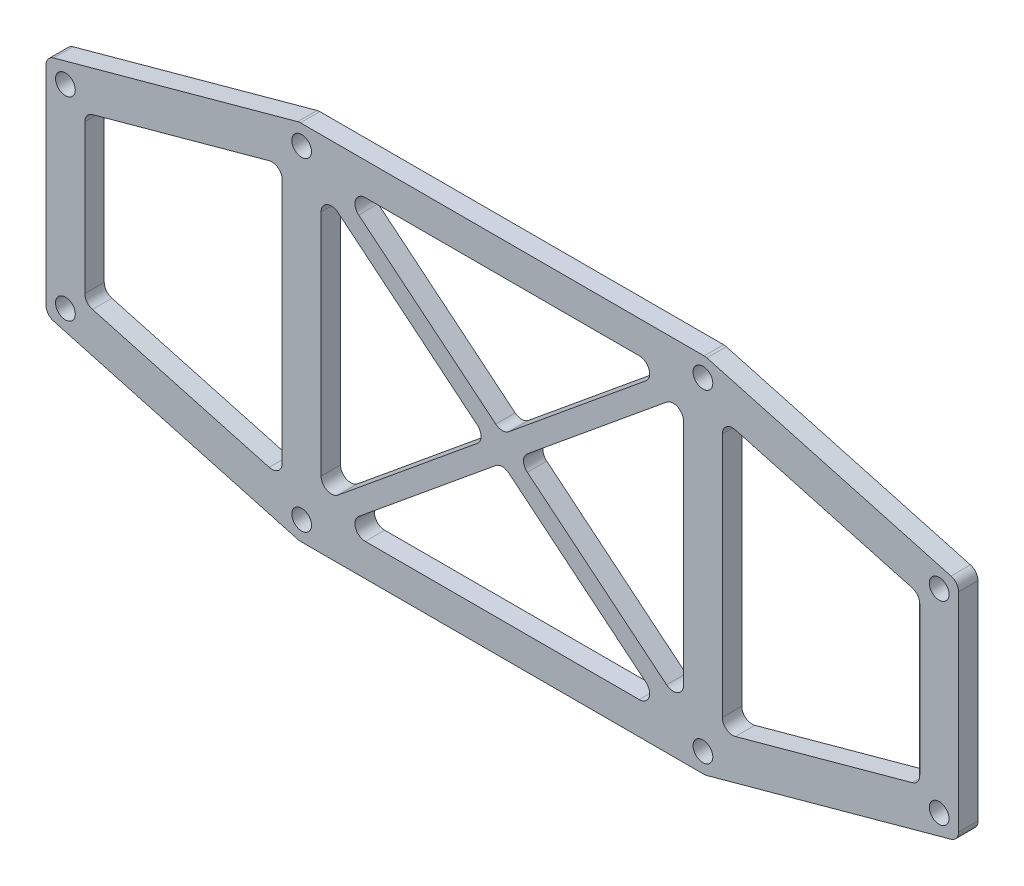
from build123d import *

# Parameters (mm, degrees)
SKETCH_1_R          = 1.525
EXTRUDE_1_DEPTH     = 3
CUT_EXTRUDE_1_DEPTH = 3
CUT_EXTRUDE_2_DEPTH = 3
FILLET_1_R          = 1.6


with BuildPart() as part:
    # 草图1 → 凸台-拉伸1 (new body)
    with BuildSketch(Plane.XY):
        Polygon((-70.5, 17.288636625), (-31.403523682, 28), (31.403523682, 28), (70.5, 17.288636625), (70.5, -17.288636625), (31.403523682, -28), (-31.403523682, -28), (-70.5, -17.288636625), align=None)
        with Locations((31, 25)):
            Circle(SKETCH_1_R, mode=Mode.SUBTRACT)
        with Locations((-31, 25)):
            Circle(SKETCH_1_R, mode=Mode.SUBTRACT)
        with Locations((-31, -25)):
            Circle(SKETCH_1_R, mode=Mode.SUBTRACT)
        with Locations((31, -25)):
            Circle(SKETCH_1_R, mode=Mode.SUBTRACT)
        with Locations((-67.5, -15)):
            Circle(SKETCH_1_R, mode=Mode.SUBTRACT)
        with Locations((-67.5, 15)):
            Circle(SKETCH_1_R, mode=Mode.SUBTRACT)
        with Locations((67.5, 15)):
            Circle(SKETCH_1_R, mode=Mode.SUBTRACT)
        with Locations((67.5, -15)):
            Circle(SKETCH_1_R, mode=Mode.SUBTRACT)
    extrude(amount=EXTRUDE_1_DEPTH)

    # 草图2 → 切除-拉伸1 (cut)
    with BuildSketch(Plane.XY.offset(3)):
        Polygon((-28, 21.058820972), (-28, -21.058820972), (-2.363174469, 0), align=None)
        Polygon((0, -1.941179028), (-25.636825531, -23), (25.636825531, -23), align=None)
        Polygon((28, 21.058820972), (2.363174469, 0), (28, -21.058820972), align=None)
        Polygon((-25.636825531, 23), (0, 1.941179028), (25.636825531, 23), align=None)
    extrude(amount=-CUT_EXTRUDE_1_DEPTH, mode=Mode.SUBTRACT)

    # 草图3 → 切除-拉伸2 (cut)
    with BuildSketch(Plane.XY.offset(3)):
        Polygon((34, 21.067527758), (34, -21.067527758), (64.5, -12.711363375), (64.5, 12.711363375), align=None)
        Polygon((-64.5, 12.711363375), (-34, 21.067527758), (-34, -21.067527758), (-64.5, -12.711363375), align=None)
    extrude(amount=-CUT_EXTRUDE_2_DEPTH, mode=Mode.SUBTRACT)

    # 圆角1
    fillet_1_edges = [part.edges().sort_by_distance(p)[0] for p in [
        (34, 21.067527758, 1.5),
        (64.5, 12.711363375, 1.5),
        (64.5, -12.711363375, 1.5),
        (34, -21.067527758, 1.5),
        (-34, 21.067527758, 1.5),
        (-34, -21.067527758, 1.5),
        (-64.5, -12.711363375, 1.5),
        (-64.5, 12.711363375, 1.5),
        (-70.5, 17.288636625, 1.5),
        (-31.403523682, 28, 1.5),
        (31.403523682, 28, 1.5),
        (70.5, 17.288636625, 1.5),
        (70.5, -17.288636625, 1.5),
        (31.403523682, -28, 1.5),
        (-31.403523682, -28, 1.5),
        (-70.5, -17.288636625, 1.5),
        (2.363174469, 0, 1.5),
        (28, 21.058820972, 1.5),
        (28, -21.058820972, 1.5),
        (-25.636825531, -23, 1.5),
        (0, -1.941179028, 1.5),
        (25.636825531, -23, 1.5),
        (0, 1.941179028, 1.5),
        (-25.636825531, 23, 1.5),
        (25.636825531, 23, 1.5),
        (-28, -21.058820972, 1.5),
        (-28, 21.058820972, 1.5),
        (-2.363174469, 0, 1.5),
    ]]
    fillet(fillet_1_edges, radius=FILLET_1_R)


solid = part.part
